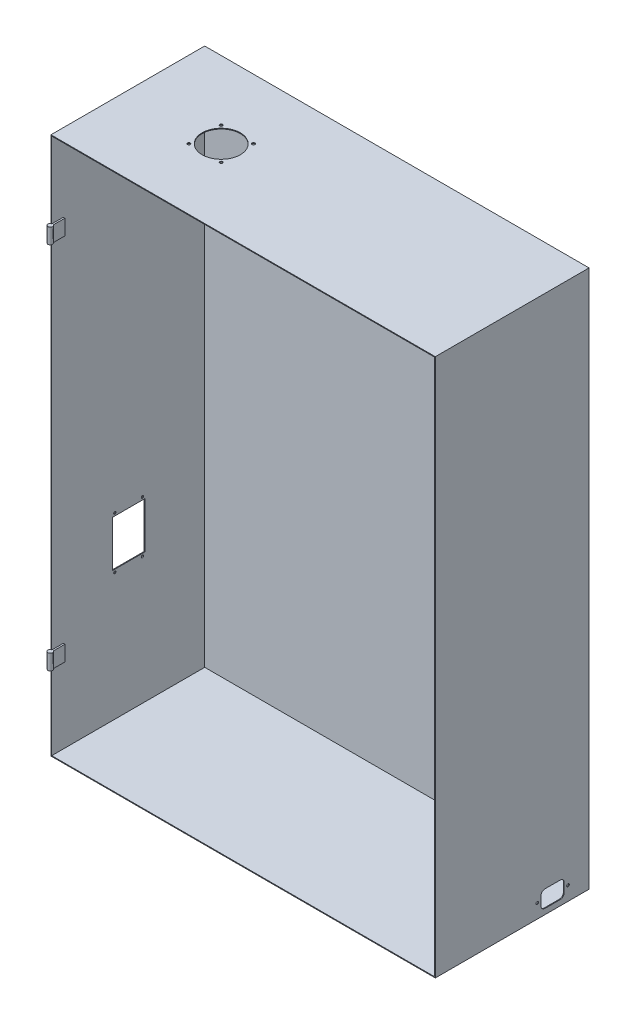
from build123d import *

# Parameters (mm, degrees)
CROQUIS1_W              = 500
CROQUIS1_H              = 700
SALIENTE_EXTRUIR1_DEPTH = 200
VACIADO1_T              = -1
CROQUIS2_W              = 15
CROQUIS2_H              = 20
SALIENTE_EXTRUIR2_DEPTH = 2
SALIENTE_EXTRUIR3_START = -20
CROQUIS3_R              = 3
SALIENTE_EXTRUIR3_DEPTH = 20
SALIENTE_EXTRUIR4_START = -20
SALIENTE_EXTRUIR4_DEPTH = 20
CROQUIS5_W              = 42
CROQUIS5_H              = 60
CORTAR_EXTRUIR1_DEPTH   = 10
CROQUIS6_R              = 1.5
CORTAR_EXTRUIR2_DEPTH   = 10
CORTAR_EXTRUIR3_DEPTH   = 10
CROQUIS8_R              = 1.7
CORTAR_EXTRUIR4_DEPTH   = 10
CROQUIS9_R              = 24.815
CROQUIS9_R_2            = 1.85
CORTAR_EXTRUIR5_DEPTH   = 10


with BuildPart() as part:
    # Croquis1 → Saliente-Extruir1 (new body)
    with BuildSketch(Plane.XY):
        Rectangle(CROQUIS1_W, CROQUIS1_H)
    extrude(amount=SALIENTE_EXTRUIR1_DEPTH)

    # Vaciado1
    vaciado1_openings = [part.faces().sort_by_distance(p)[0] for p in [
        (0, 0, 200),
    ]]
    offset(amount=VACIADO1_T, openings=vaciado1_openings, kind=Kind.INTERSECTION)

    # Croquis2 → Saliente-Extruir2 (add)
    with BuildSketch(Plane(origin=(-249, 0, 0), x_dir=(0, 0, -1), z_dir=(1, 0, 0))):
        with Locations((-192.5, 240)):
            Rectangle(CROQUIS2_W, CROQUIS2_H)
        with Locations((-192.5, -240)):
            Rectangle(CROQUIS2_W, CROQUIS2_H)
    extrude(amount=SALIENTE_EXTRUIR2_DEPTH)

    # Croquis3 → Saliente-Extruir3 (add)
    with BuildSketch(Plane.XZ.offset(250).offset(SALIENTE_EXTRUIR3_START)):
        with Locations((-248.5, 202.5)):
            Circle(CROQUIS3_R)
    extrude(amount=SALIENTE_EXTRUIR3_DEPTH)

    # Croquis4 → Saliente-Extruir4 (add)
    with BuildSketch(Plane.XZ.offset(-230).offset(SALIENTE_EXTRUIR4_START)):
        with BuildLine():
            Line((-250, 199.901923789), (-247, 199.901923789))
            ThreePointArc((-247, 199.901923789), (-248.5, 205.5), (-250, 199.901923789))
        make_face()
    extrude(amount=SALIENTE_EXTRUIR4_DEPTH)

    # Croquis5 → Cortar-Extruir1 (cut)
    with BuildSketch(Plane(origin=(-249, 0, 0), x_dir=(0, 0, -1), z_dir=(1, 0, 0))):
        with Locations((-100, -150)):
            Rectangle(CROQUIS5_W, CROQUIS5_H)
    extrude(amount=-CORTAR_EXTRUIR1_DEPTH, mode=Mode.SUBTRACT)

    # Croquis6 → Cortar-Extruir2 (cut)
    with BuildSketch(Plane(origin=(-249, 0, 0), x_dir=(0, 0, -1), z_dir=(1, 0, 0))):
        with Locations((-118.05, -116.5)):
            Circle(CROQUIS6_R)
        with Locations((-82.05, -116.5)):
            Circle(CROQUIS6_R)
        with Locations((-82.05, -183.5)):
            Circle(CROQUIS6_R)
        with Locations((-118.05, -183.5)):
            Circle(CROQUIS6_R)
        Polygon((-204.984566909, 349), (-205.984152301, 348), (-703.777677317, 348), (-703.777677317, -350), (-205.984152301, -350), (-204.984566909, -351), (-204.984566909, -231), (-219.978347783, -231), (-219.978347783, -211), (-204.984566909, -211), (-204.984566909, 209), (-219.978347783, 209), (-219.978347783, 229), (-204.984566909, 229), align=None)
    extrude(amount=-CORTAR_EXTRUIR2_DEPTH, mode=Mode.SUBTRACT)

    # Croquis7 → Cortar-Extruir3 (cut)
    with BuildSketch(Plane(origin=(250, 0, 0), x_dir=(0, 0, -1), z_dir=(1, 0, 0))):
        with BuildLine():
            Line((-37.394449056, -342.885415535), (-57.394449056, -342.885415535))
            ThreePointArc((-57.394449056, -342.885415535), (-60.929982962, -341.420949441), (-62.394449056, -337.885415535))
            Line((-62.394449056, -337.885415535), (-62.394449056, -325.885415535))
            ThreePointArc((-62.394449056, -325.885415535), (-60.929982962, -322.349881629), (-57.394449056, -320.885415535))
            Line((-57.394449056, -320.885415535), (-37.394449056, -320.885415535))
            ThreePointArc((-37.394449056, -320.885415535), (-33.85891515, -322.349881629), (-32.394449056, -325.885415535))
            Line((-32.394449056, -325.885415535), (-32.394449056, -337.885415535))
            ThreePointArc((-32.394449056, -337.885415535), (-33.85891515, -341.420949441), (-37.394449056, -342.885415535))
        make_face()
    extrude(amount=-CORTAR_EXTRUIR3_DEPTH, mode=Mode.SUBTRACT)

    # Croquis8 → Cortar-Extruir4 (cut)
    with BuildSketch(Plane.ZY.offset(-249)):
        with Locations((27.394449056, -331.885415535)):
            Circle(CROQUIS8_R)
        with Locations((67.394449056, -331.885415535)):
            Circle(CROQUIS8_R)
    extrude(amount=-CORTAR_EXTRUIR4_DEPTH, mode=Mode.SUBTRACT)

    # Croquis9 → Cortar-Extruir5 (cut)
    with BuildSketch(Plane.XZ.offset(-349)):
        with Locations(Location((-129.140668179, 99.383298184, 0), (0, 0, 270))):
            Circle(CROQUIS9_R)
        with Locations(Location((-150.140668179, 120.423298184, 0), (0, 0, 270))):
            Circle(CROQUIS9_R_2)
        with Locations(Location((-108.140668179, 120.423298184, 0), (0, 0, 270))):
            Circle(CROQUIS9_R_2)
        with Locations(Location((-150.140668179, 78.423298184, 0), (0, 0, 270))):
            Circle(CROQUIS9_R_2)
        with Locations(Location((-108.140668179, 78.423298184, 0), (0, 0, 270))):
            Circle(CROQUIS9_R_2)
    extrude(amount=-CORTAR_EXTRUIR5_DEPTH, mode=Mode.SUBTRACT)


solid = part.part
